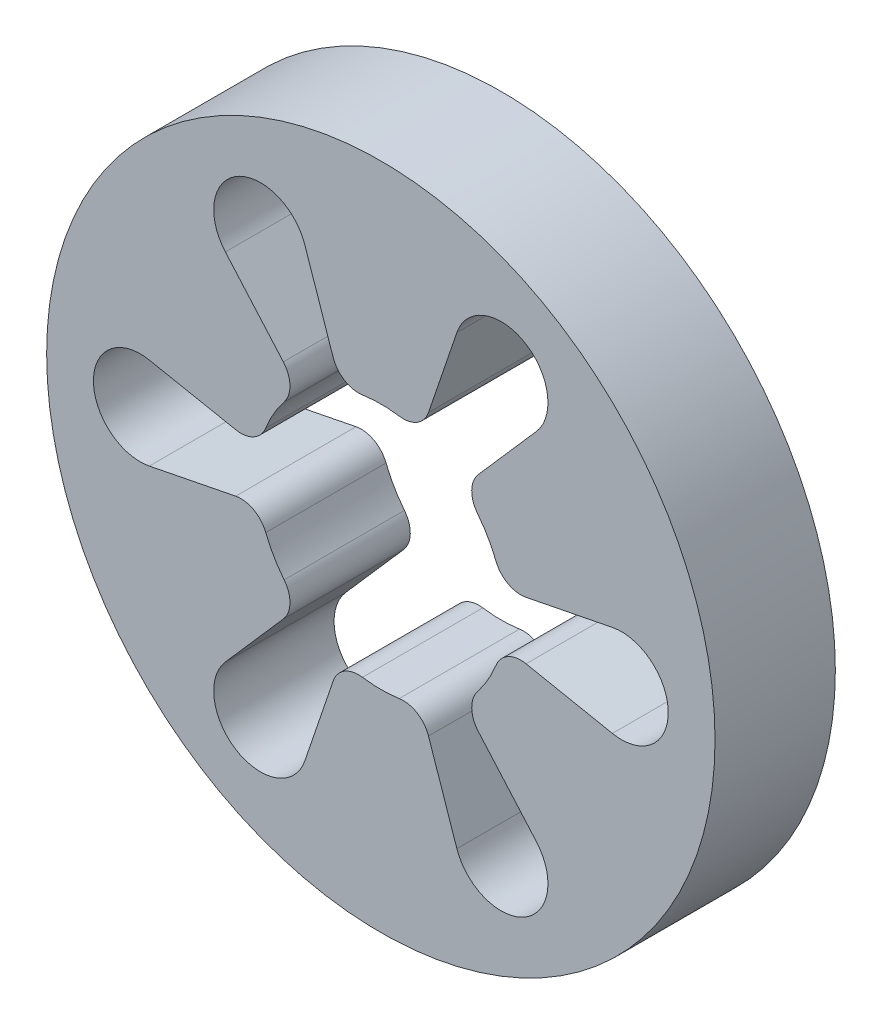
from build123d import *

# Parameters (mm, degrees)
SKETCH1_R           = 158.75
BOSS_EXTRUDE1_DEPTH = 28.575


with BuildPart() as part:
    # Sketch1 → Boss-Extrude1 (new, symmetric)
    with BuildSketch(Plane(origin=(0, 0, 0), x_dir=(0, 1, 0), z_dir=(0, 0, 1))):
        with Locations(Location((0, 0, 0), (0, 0, 270))):
            Circle(SKETCH1_R)
        with BuildLine():
            Line((21.800803257, 109.978472222), (13.669356496, 68.957777656))
            ThreePointArc((13.669356496, 68.957777656), (14.983750202, 60.395804017), (21.482165761, 54.668185085))
            ThreePointArc((21.482165761, 54.668185085), (29.36875, 50.868167155), (36.602954182, 45.93819382))
            ThreePointArc((36.602954182, 45.93819382), (44.81242546, 43.174210327), (52.88450899, 46.316898807))
            Line((52.88450899, 46.316898807), (84.343749185, 73.869285555))
            ThreePointArc((84.343749185, 73.869285555), (118.234118252, 68.2625), (106.144552443, 36.109186667))
            Line((106.144552443, 36.109186667), (66.553865487, 22.640878849))
            ThreePointArc((66.553865487, 22.640878849), (59.796175661, 17.22159369), (58.085119943, 8.729991265))
            ThreePointArc((58.085119943, 8.729991265), (58.7375, 0), (58.085119943, -8.729991265))
            ThreePointArc((58.085119943, -8.729991265), (59.796175661, -17.22159369), (66.553865487, -22.640878849))
            Line((66.553865487, -22.640878849), (106.144552443, -36.109186667))
            ThreePointArc((106.144552443, -36.109186667), (118.234118252, -68.2625), (84.343749185, -73.869285555))
            Line((84.343749185, -73.869285555), (52.88450899, -46.316898807))
            ThreePointArc((52.88450899, -46.316898807), (44.81242546, -43.174210327), (36.602954182, -45.93819382))
            ThreePointArc((36.602954182, -45.93819382), (29.36875, -50.868167155), (21.482165761, -54.668185085))
            ThreePointArc((21.482165761, -54.668185085), (14.983750202, -60.395804017), (13.669356496, -68.957777656))
            Line((13.669356496, -68.957777656), (21.800803257, -109.978472222))
            ThreePointArc((21.800803257, -109.978472222), (0, -136.525), (-21.800803257, -109.978472222))
            Line((-21.800803257, -109.978472222), (-13.669356496, -68.957777656))
            ThreePointArc((-13.669356496, -68.957777656), (-14.983750202, -60.395804017), (-21.482165761, -54.668185085))
            ThreePointArc((-21.482165761, -54.668185085), (-29.36875, -50.868167155), (-36.602954182, -45.93819382))
            ThreePointArc((-36.602954182, -45.93819382), (-44.81242546, -43.174210327), (-52.88450899, -46.316898807))
            Line((-52.88450899, -46.316898807), (-84.343749185, -73.869285555))
            ThreePointArc((-84.343749185, -73.869285555), (-118.234118252, -68.2625), (-106.144552443, -36.109186667))
            Line((-106.144552443, -36.109186667), (-66.553865487, -22.640878849))
            ThreePointArc((-66.553865487, -22.640878849), (-59.796175661, -17.22159369), (-58.085119943, -8.729991265))
            ThreePointArc((-58.085119943, -8.729991265), (-58.7375, 0), (-58.085119943, 8.729991265))
            ThreePointArc((-58.085119943, 8.729991265), (-59.796175661, 17.22159369), (-66.553865487, 22.640878849))
            Line((-66.553865487, 22.640878849), (-106.144552443, 36.109186667))
            ThreePointArc((-106.144552443, 36.109186667), (-118.234118252, 68.2625), (-84.343749185, 73.869285555))
            Line((-84.343749185, 73.869285555), (-52.88450899, 46.316898807))
            ThreePointArc((-52.88450899, 46.316898807), (-44.81242546, 43.174210327), (-36.602954182, 45.93819382))
            ThreePointArc((-36.602954182, 45.93819382), (-29.36875, 50.868167155), (-21.482165761, 54.668185085))
            ThreePointArc((-21.482165761, 54.668185085), (-14.983750202, 60.395804017), (-13.669356496, 68.957777656))
            Line((-13.669356496, 68.957777656), (-21.800803257, 109.978472222))
            ThreePointArc((-21.800803257, 109.978472222), (0, 136.525), (21.800803257, 109.978472222))
        make_face(mode=Mode.SUBTRACT)
    extrude(amount=BOSS_EXTRUDE1_DEPTH, both=True)


solid = part.part
